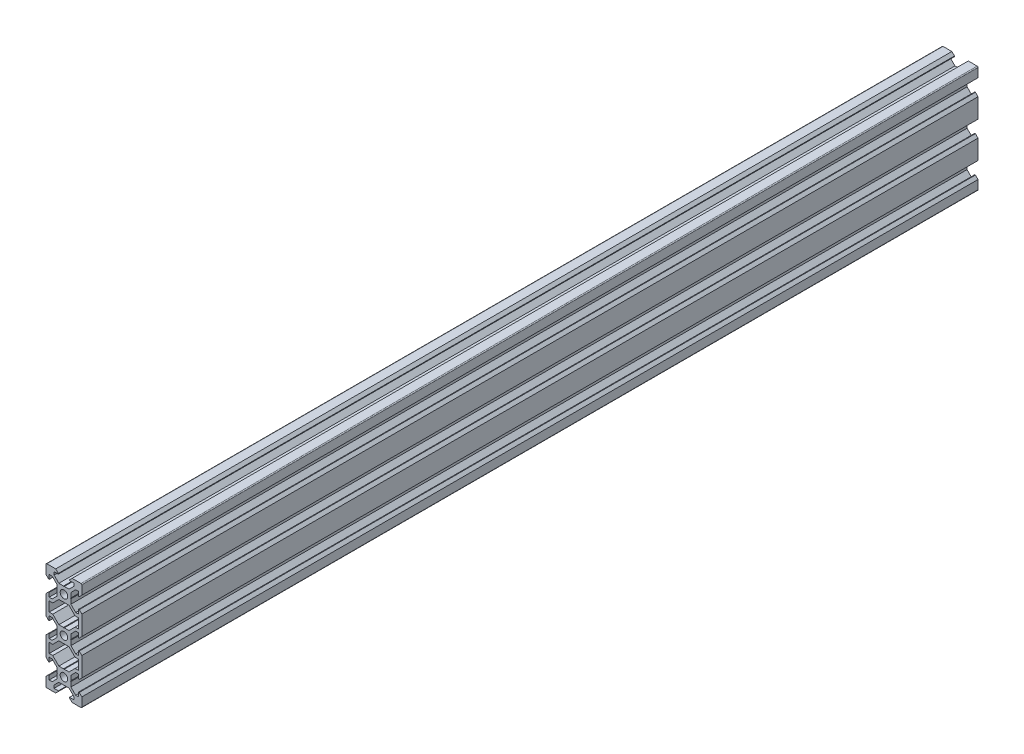
from build123d import *

# Parameters (mm, degrees)
SKETCH2_R           = 2.1
BOSS_EXTRUDE2_DEPTH = 500


with BuildPart() as part:
    # Sketch2 → Boss-Extrude2 (new body)
    with BuildSketch(Plane.XY):
        with BuildLine():
            Line((-9.5, 10), (-4.58, 10))
            Line((-4.58, 10), (-3.13, 8.55))
            Line((-3.13, 8.55), (-3.13, 8.2))
            Line((-3.13, 8.2), (-5.5, 8.2))
            Line((-5.5, 8.2), (-5.5, 6.56))
            Line((-5.5, 6.56), (-2.84, 3.9))
            Line((-2.84, 3.9), (-0.21, 3.9))
            Line((-0.21, 3.9), (0, 3.69))
            Line((0, 3.69), (0.21, 3.9))
            Line((0.21, 3.9), (2.84, 3.9))
            Line((2.84, 3.9), (5.5, 6.56))
            Line((5.5, 6.56), (5.5, 8.2))
            Line((5.5, 8.2), (3.13, 8.2))
            Line((3.13, 8.2), (3.13, 8.55))
            Line((3.13, 8.55), (4.58, 10))
            Line((4.58, 10), (9.5, 10))
            ThreePointArc((9.5, 10), (9.853553391, 9.853553391), (10, 9.5))
            Line((10, 9.5), (10, 4.58))
            Line((10, 4.58), (8.55, 3.13))
            Line((8.55, 3.13), (8.2, 3.13))
            Line((8.2, 3.13), (8.2, 5.5))
            Line((8.2, 5.5), (6.56, 5.5))
            Line((6.56, 5.5), (3.9, 2.84))
            Line((3.9, 2.84), (3.9, 0.21))
            Line((3.9, 0.21), (3.69, 0))
            Line((3.69, 0), (3.9, -0.21))
            Line((3.9, -0.21), (3.9, -2.84))
            Line((3.9, -2.84), (6.56, -5.5))
            Line((6.56, -5.5), (8.2, -5.5))
            Line((8.2, -5.5), (8.2, -3.13))
            Line((8.2, -3.13), (8.55, -3.13))
            Line((8.55, -3.13), (10, -4.58))
            Line((10, -4.58), (10, -10))
            Line((10, -10), (10, -15.42))
            Line((10, -15.42), (8.55, -16.87))
            Line((8.55, -16.87), (8.2, -16.87))
            Line((8.2, -16.87), (8.2, -14.5))
            Line((8.2, -14.5), (6.56, -14.5))
            Line((6.56, -14.5), (3.9, -17.16))
            Line((3.9, -17.16), (3.9, -19.79))
            Line((3.9, -19.79), (3.69, -20))
            Line((3.69, -20), (3.9, -20.21))
            Line((3.9, -20.21), (3.9, -22.84))
            Line((3.9, -22.84), (6.56, -25.5))
            Line((6.56, -25.5), (8.2, -25.5))
            Line((8.2, -25.5), (8.2, -23.13))
            Line((8.2, -23.13), (8.55, -23.13))
            Line((8.55, -23.13), (10, -24.58))
            Line((10, -24.58), (10, -30))
            Line((10, -30), (10, -35.42))
            Line((10, -35.42), (8.55, -36.87))
            Line((8.55, -36.87), (8.2, -36.87))
            Line((8.2, -36.87), (8.2, -34.5))
            Line((8.2, -34.5), (6.56, -34.5))
            Line((6.56, -34.5), (3.9, -37.16))
            Line((3.9, -37.16), (3.9, -39.79))
            Line((3.9, -39.79), (3.69, -40))
            Line((3.69, -40), (3.9, -40.21))
            Line((3.9, -40.21), (3.9, -42.84))
            Line((3.9, -42.84), (6.56, -45.5))
            Line((6.56, -45.5), (8.2, -45.5))
            Line((8.2, -45.5), (8.2, -43.13))
            Line((8.2, -43.13), (8.55, -43.13))
            Line((8.55, -43.13), (10, -44.58))
            Line((10, -44.58), (10, -49.5))
            ThreePointArc((10, -49.5), (9.853553391, -49.853553391), (9.5, -50))
            Line((9.5, -50), (4.58, -50))
            Line((4.58, -50), (3.13, -48.55))
            Line((3.13, -48.55), (3.13, -48.2))
            Line((3.13, -48.2), (5.5, -48.2))
            Line((5.5, -48.2), (5.5, -46.56))
            Line((5.5, -46.56), (2.84, -43.9))
            Line((2.84, -43.9), (0.21, -43.9))
            Line((0.21, -43.9), (0, -43.69))
            Line((0, -43.69), (-0.21, -43.9))
            Line((-0.21, -43.9), (-2.84, -43.9))
            Line((-2.84, -43.9), (-5.5, -46.56))
            Line((-5.5, -46.56), (-5.5, -48.2))
            Line((-5.5, -48.2), (-3.13, -48.2))
            Line((-3.13, -48.2), (-3.13, -48.55))
            Line((-3.13, -48.55), (-4.58, -50))
            Line((-4.58, -50), (-9.5, -50))
            ThreePointArc((-9.5, -50), (-9.853553391, -49.853553391), (-10, -49.5))
            Line((-10, -49.5), (-10, -44.58))
            Line((-10, -44.58), (-8.55, -43.13))
            Line((-8.55, -43.13), (-8.2, -43.13))
            Line((-8.2, -43.13), (-8.2, -45.5))
            Line((-8.2, -45.5), (-6.56, -45.5))
            Line((-6.56, -45.5), (-3.9, -42.84))
            Line((-3.9, -42.84), (-3.9, -40.21))
            Line((-3.9, -40.21), (-3.69, -40))
            Line((-3.69, -40), (-3.9, -39.79))
            Line((-3.9, -39.79), (-3.9, -37.16))
            Line((-3.9, -37.16), (-6.56, -34.5))
            Line((-6.56, -34.5), (-8.2, -34.5))
            Line((-8.2, -34.5), (-8.2, -36.87))
            Line((-8.2, -36.87), (-8.55, -36.87))
            Line((-8.55, -36.87), (-10, -35.42))
            Line((-10, -35.42), (-10, -30))
            Line((-10, -30), (-10, -24.58))
            Line((-10, -24.58), (-8.55, -23.13))
            Line((-8.55, -23.13), (-8.2, -23.13))
            Line((-8.2, -23.13), (-8.2, -25.5))
            Line((-8.2, -25.5), (-6.56, -25.5))
            Line((-6.56, -25.5), (-3.9, -22.84))
            Line((-3.9, -22.84), (-3.9, -20.21))
            Line((-3.9, -20.21), (-3.69, -20))
            Line((-3.69, -20), (-3.9, -19.79))
            Line((-3.9, -19.79), (-3.9, -17.16))
            Line((-3.9, -17.16), (-6.56, -14.5))
            Line((-6.56, -14.5), (-8.2, -14.5))
            Line((-8.2, -14.5), (-8.2, -16.87))
            Line((-8.2, -16.87), (-8.55, -16.87))
            Line((-8.55, -16.87), (-10, -15.42))
            Line((-10, -15.42), (-10, -10))
            Line((-10, -10), (-10, -4.58))
            Line((-10, -4.58), (-8.55, -3.13))
            Line((-8.55, -3.13), (-8.2, -3.13))
            Line((-8.2, -3.13), (-8.2, -5.5))
            Line((-8.2, -5.5), (-6.56, -5.5))
            Line((-6.56, -5.5), (-3.9, -2.84))
            Line((-3.9, -2.84), (-3.9, -0.21))
            Line((-3.9, -0.21), (-3.69, 0))
            Line((-3.69, 0), (-3.9, 0.21))
            Line((-3.9, 0.21), (-3.9, 2.84))
            Line((-3.9, 2.84), (-6.56, 5.5))
            Line((-6.56, 5.5), (-8.2, 5.5))
            Line((-8.2, 5.5), (-8.2, 3.13))
            Line((-8.2, 3.13), (-8.55, 3.13))
            Line((-8.55, 3.13), (-10, 4.58))
            Line((-10, 4.58), (-10, 9.5))
            ThreePointArc((-10, 9.5), (-9.853553391, 9.853553391), (-9.5, 10))
        make_face()
        with Locations((0, -20)):
            Circle(SKETCH2_R, mode=Mode.SUBTRACT)
        Circle(SKETCH2_R, mode=Mode.SUBTRACT)
        with Locations((0, -40)):
            Circle(SKETCH2_R, mode=Mode.SUBTRACT)
        Polygon((0.21, -3.9), (0, -3.69), (-0.21, -3.9), (-2.84, -3.9), (-6.24, -7.3), (-8.2, -7.3), (-8.2, -12.7), (-6.24, -12.7), (-2.84, -16.1), (-0.21, -16.1), (0, -16.31), (0.21, -16.1), (2.84, -16.1), (6.24, -12.7), (8.2, -12.7), (8.2, -10), (8.2, -7.3), (6.24, -7.3), (2.84, -3.9), align=None, mode=Mode.SUBTRACT)
        Polygon((-0.21, -36.1), (0, -36.31), (0.21, -36.1), (2.84, -36.1), (6.24, -32.7), (8.2, -32.7), (8.2, -30), (8.2, -27.3), (6.24, -27.3), (2.84, -23.9), (0.21, -23.9), (0, -23.69), (-0.21, -23.9), (-2.84, -23.9), (-6.24, -27.3), (-8.2, -27.3), (-8.2, -32.7), (-6.24, -32.7), (-2.84, -36.1), align=None, mode=Mode.SUBTRACT)
    extrude(amount=-BOSS_EXTRUDE2_DEPTH)


solid = part.part
